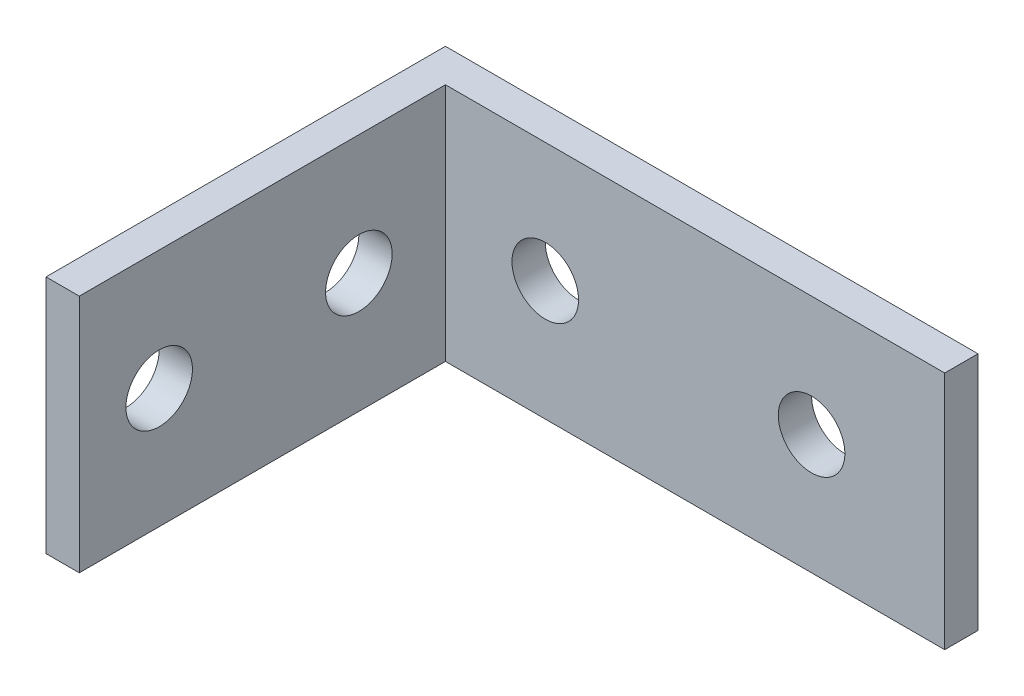
from build123d import *

# Parameters (mm, degrees)
BOSS_EXTRUDE1_DEPTH         = 22.86
F_1_4_0_25_DIAMETER_HOLE1_D = 6.35
F_1_4_0_25_DIAMETER_HOLE2_D = 6.35


with BuildPart() as part:
    # Sketch1 → Boss-Extrude1 (new body)
    with BuildSketch(Plane(origin=(0, 0, 0), x_dir=(1, 0, 0), z_dir=(0, 1, 0))):
        Polygon((0, 0), (0, 38.1), (50.8, 38.1), (50.8, 34.925), (3.175, 34.925), (3.175, 0), align=None)
    extrude(amount=BOSS_EXTRUDE1_DEPTH)

    # 1/4 (0.25) Diameter Hole1 (through all)
    with Locations(Plane(origin=(3.175, 0, 0), x_dir=(0, 0, -1), z_dir=(1, 0, 0))):
        with Locations((7.62, 11.43), (26.67, 11.43)):
            Hole(F_1_4_0_25_DIAMETER_HOLE1_D / 2)

    # 1/4 (0.25) Diameter Hole2 (through all)
    with Locations(Plane(origin=(0, 0, -38.1), x_dir=(-1, 0, 0), z_dir=(0, 0, -1))):
        with Locations((-38.1, 11.43), (-12.7, 11.43)):
            Hole(F_1_4_0_25_DIAMETER_HOLE2_D / 2)


solid = part.part
